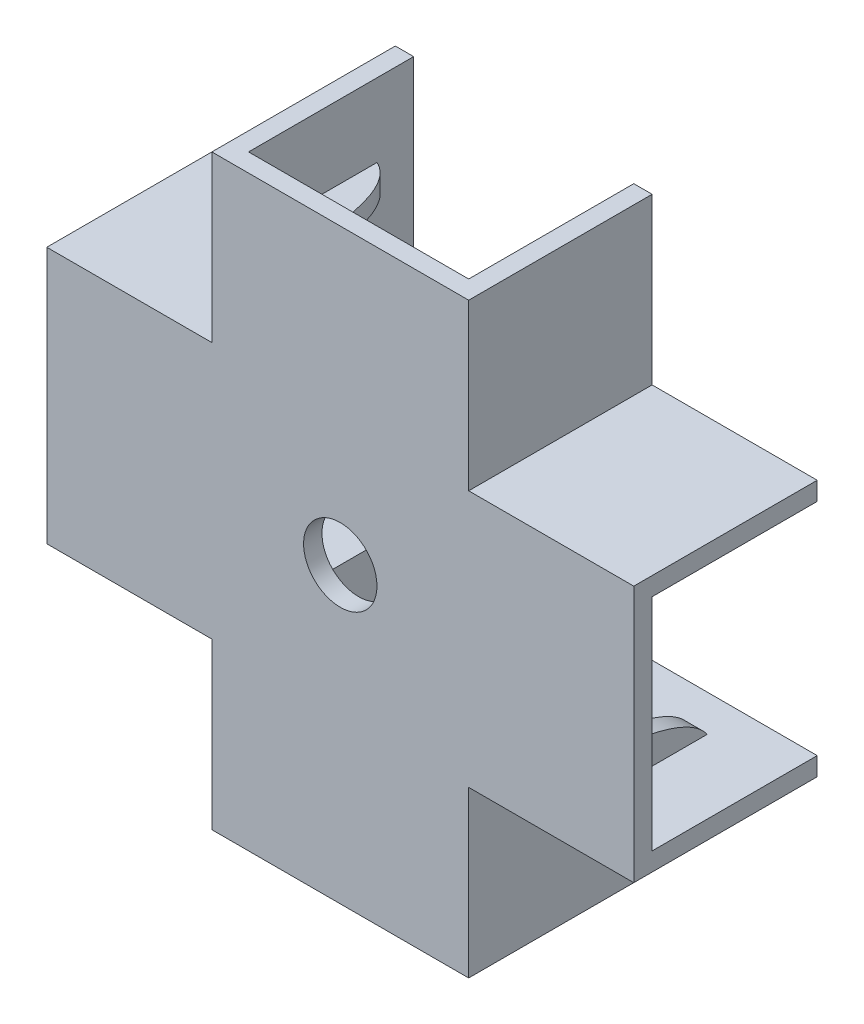
from build123d import *

# Parameters (mm, degrees)
CROQUIS1_R                   = 2000
SALIENTE_EXTRUIR1_DEPTH      = 1000
SALIENTE_EXTRUIR2_DEPTH      = 10000
SALIENTE_EXTRUIR3_DEPTH      = 500
SALIENTE_EXTRUIR3_DEPTH_BACK = 500
SALIENTE_EXTRUIR4_DEPTH      = 500
SALIENTE_EXTRUIR4_DEPTH_BACK = 500
SALIENTE_EXTRUIR5_DEPTH      = 500
SALIENTE_EXTRUIR5_DEPTH_BACK = 500
SALIENTE_EXTRUIR6_DEPTH      = 500
SALIENTE_EXTRUIR6_DEPTH_BACK = 500


with BuildPart() as part:
    # Croquis1 → Saliente-Extruir1 (new body)
    with BuildSketch(Plane.XY):
        Polygon((117743.416897498, 161337.836627923), (117743.416897498, 152337.836627923), (131743.416897498, 152337.836627923), (131743.416897498, 161337.836627923), (140743.416897498, 161337.836627923), (140743.416897498, 175337.836627923), (131743.416897498, 175337.836627923), (131743.416897498, 184337.836627923), (117743.416897498, 184337.836627923), (117743.416897498, 175337.836627923), (108743.416897498, 175337.836627923), (108743.416897498, 161337.836627923), align=None)
        with Locations((124743.416897498, 168337.836627923)):
            Circle(CROQUIS1_R, mode=Mode.SUBTRACT)
    extrude(amount=-SALIENTE_EXTRUIR1_DEPTH)

    # Croquis1<6> → Saliente-Extruir2 (add)
    with BuildSketch(Plane.XY):
        Polygon((117743.416897498, 161337.836627923), (117743.416897498, 152337.836627923), (118743.416897498, 152337.836627923), (118743.416897498, 162337.836627923), (108743.416897498, 162337.836627923), (108743.416897498, 161337.836627923), align=None)
        Polygon((130743.416897498, 152337.836627923), (131743.416897498, 152337.836627923), (131743.416897498, 161337.836627923), (140743.416897498, 161337.836627923), (140743.416897498, 162337.836627923), (130743.416897498, 162337.836627923), align=None)
        Polygon((108743.416897498, 174337.836627923), (118743.416897498, 174337.836627923), (118743.416897498, 184337.836627923), (117743.416897498, 184337.836627923), (117743.416897498, 175337.836627923), (108743.416897498, 175337.836627923), align=None)
        Polygon((130743.416897498, 174337.836627923), (140743.416897498, 174337.836627923), (140743.416897498, 175337.836627923), (131743.416897498, 175337.836627923), (131743.416897498, 184337.836627923), (130743.416897498, 184337.836627923), align=None)
    extrude(amount=-SALIENTE_EXTRUIR2_DEPTH)

    # Croquis2 → Saliente-Extruir3 (add, two sides: drawn at the far end of the back side and taken through both)
    with BuildSketch(Plane(origin=(0, 156837.836627923, 0), x_dir=(1, 0, 0), z_dir=(0, 1, 0)).offset(-SALIENTE_EXTRUIR3_DEPTH_BACK)):
        with BuildLine():
            add(Edge.make_bspline(
                [(118743.416897498, 8000), (120739.811138244, 7120.578794783), (120743.416897498, 1000)],
                knots=[0, 0, 0, 0.514460755, 0.514460755, 0.514460755], degree=2))
            Line((118743.416897498, 8000), (118743.416897498, 1000))
            Line((118743.416897498, 1000), (120743.416897498, 1000))
        make_face()
        with BuildLine():
            Line((130743.416897498, 1000), (130743.416897498, 8000))
            add(Edge.make_bspline(
                [(130743.416897498, 8000), (128761.675222051, 7234.348262256), (128743.416897498, 1000)],
                knots=[0, 0, 0, 0.590989184, 0.590989184, 0.590989184], degree=2))
            Line((128743.416897498, 1000), (130743.416897498, 1000))
        make_face()
    extrude(amount=SALIENTE_EXTRUIR3_DEPTH + SALIENTE_EXTRUIR3_DEPTH_BACK)

    # Croquis3 → Saliente-Extruir4 (add, two sides: drawn at the far end of the back side and taken through both)
    with BuildSketch(Plane(origin=(0, 179837.836627923, 0), x_dir=(1, 0, 0), z_dir=(0, 1, 0)).offset(-SALIENTE_EXTRUIR4_DEPTH_BACK)):
        with BuildLine():
            add(Edge.make_bspline(
                [(130743.416897498, 8000), (128761.675222051, 7234.348262256), (128743.416897498, 1000)],
                knots=[0, 0, 0, 1, 1, 1], degree=2))
            Line((128743.416897498, 1000), (130743.416897498, 1000))
            Line((130743.416897498, 1000), (130743.416897498, 8000))
        make_face()
        with BuildLine():
            Line((118743.416897498, 8000), (118743.416897498, 1000))
            Line((118743.416897498, 1000), (120743.416897498, 1000))
            add(Edge.make_bspline(
                [(118743.416897498, 8000), (120739.811138244, 7120.578794783), (120743.416897498, 1000)],
                knots=[0, 0, 0, 1, 1, 1], degree=2))
        make_face()
    extrude(amount=SALIENTE_EXTRUIR4_DEPTH + SALIENTE_EXTRUIR4_DEPTH_BACK)

    # Croquis4 → Saliente-Extruir5 (add, two sides: drawn at the far end of the back side and taken through both)
    with BuildSketch(Plane(origin=(113243.416897498, 0, 0), x_dir=(0, 0, -1), z_dir=(1, 0, 0)).offset(-SALIENTE_EXTRUIR5_DEPTH_BACK)):
        with BuildLine():
            Line((8000, 174337.836627923), (0, 174337.836627923))
            Line((0, 174337.836627923), (0, 172337.836627923))
            add(Edge.make_bspline(
                [(8000, 174337.836627923), (6599.854554041, 172118.74354217), (0, 172337.836627923)],
                knots=[0, 0, 0, 0.64837766, 0.64837766, 0.64837766], degree=2))
        make_face()
        with BuildLine():
            add(Edge.make_bspline(
                [(8000, 162337.836627923), (6698.658965378, 164240.824079883), (0, 164337.836627923)],
                knots=[0, 0, 0, 0.707529781, 0.707529781, 0.707529781], degree=2))
            Line((0, 164337.836627923), (0, 162337.836627923))
            Line((0, 162337.836627923), (8000, 162337.836627923))
        make_face()
    extrude(amount=SALIENTE_EXTRUIR5_DEPTH + SALIENTE_EXTRUIR5_DEPTH_BACK)

    # Croquis5 → Saliente-Extruir6 (add, two sides: drawn at the far end of the back side and taken through both)
    with BuildSketch(Plane(origin=(136243.416897498, 0, 0), x_dir=(0, 0, -1), z_dir=(1, 0, 0)).offset(-SALIENTE_EXTRUIR6_DEPTH_BACK)):
        with BuildLine():
            Line((0, 164337.836627923), (0, 162337.836627923))
            Line((0, 162337.836627923), (8000, 162337.836627923))
            add(Edge.make_bspline(
                [(8000, 162337.836627923), (6698.658965378, 164240.824079882), (0, 164337.836627923)],
                knots=[0, 0, 0, 1, 1, 1], degree=2))
        make_face()
        with BuildLine():
            Line((0, 174337.836627923), (0, 172337.836627923))
            add(Edge.make_bspline(
                [(8000, 174337.836627923), (6599.854554041, 172118.74354217), (0, 172337.836627923)],
                knots=[0, 0, 0, 1, 1, 1], degree=2))
            Line((8000, 174337.836627923), (0, 174337.836627923))
        make_face()
    extrude(amount=SALIENTE_EXTRUIR6_DEPTH + SALIENTE_EXTRUIR6_DEPTH_BACK)


solid = part.part
